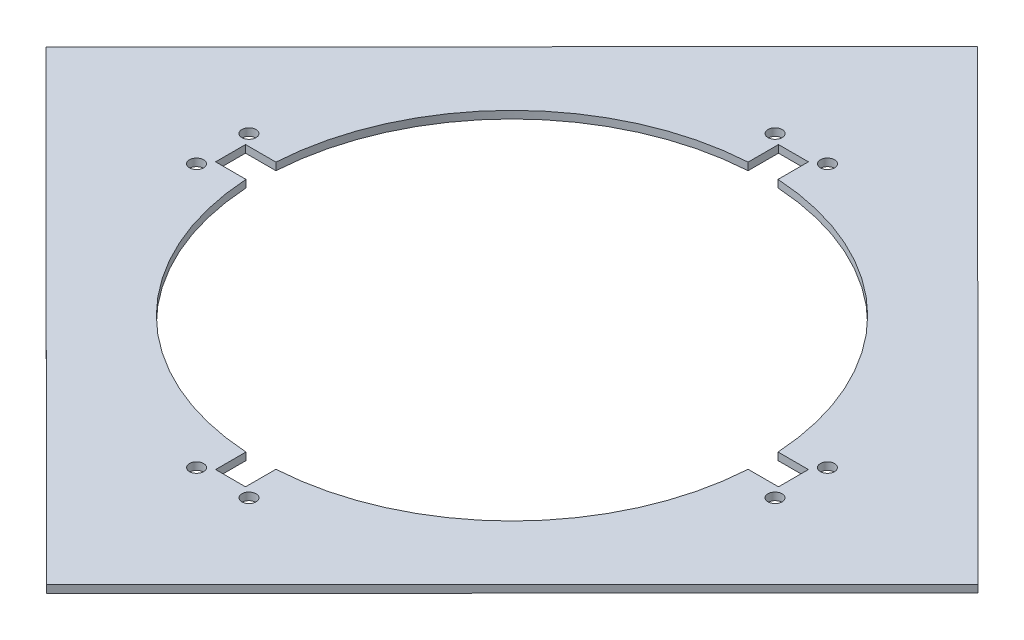
from build123d import *

# Parameters (mm, degrees)
SKETCH1_R           = 1.5
SKETCH1_R_2         = 53.34
BOSS_EXTRUDE1_DEPTH = 1.5875
CUT_EXTRUDE3_DEPTH  = 140.70900378


with BuildPart() as part:
    # Sketch1 → Boss-Extrude1 (new body)
    with BuildSketch(Plane(origin=(0, 0, 0), x_dir=(1, 0, 0), z_dir=(0, 1, 0))):
        Polygon((0.047005036, -98.782806148), (-98.782806148, -0.047005036), (-0.047005036, 98.782806148), (98.782806148, 0.047005036), align=None)
        with Locations(Location((-61.346730494, 5.55625, 0), (0, 0, 270))):
            Circle(SKETCH1_R, mode=Mode.SUBTRACT)
        with Locations(Location((-61.346730494, -5.55625, 0), (0, 0, 270))):
            Circle(SKETCH1_R, mode=Mode.SUBTRACT)
        with Locations(Location((-5.55625, -61.346730494, 0), (0, 0, 270))):
            Circle(SKETCH1_R, mode=Mode.SUBTRACT)
        with Locations(Location((5.55625, -61.346730494, 0), (0, 0, 270))):
            Circle(SKETCH1_R, mode=Mode.SUBTRACT)
        with Locations(Location((61.346730494, -5.55625, 0), (0, 0, 270))):
            Circle(SKETCH1_R, mode=Mode.SUBTRACT)
        with Locations(Location((61.346730494, 5.55625, 0), (0, 0, 270))):
            Circle(SKETCH1_R, mode=Mode.SUBTRACT)
        with Locations(Location((5.55625, 61.346730494, 0), (0, 0, 270))):
            Circle(SKETCH1_R, mode=Mode.SUBTRACT)
        with Locations(Location((-5.55625, 61.346730494, 0), (0, 0, 270))):
            Circle(SKETCH1_R, mode=Mode.SUBTRACT)
        with Locations(Location((0, 0, 0), (0, 0, 270))):
            Circle(SKETCH1_R_2, mode=Mode.SUBTRACT)
    extrude(amount=BOSS_EXTRUDE1_DEPTH)

    # Sketch2 → Cut-Extrude3 (cut, through all)
    with BuildSketch(Plane(origin=(0, 1.5875, 0), x_dir=(1, 0, 0), z_dir=(0, 1, 0))):
        Polygon((3.175, 53.34), (3.175, 59.69), (-3.175, 59.69), (-3.175, 53.34), (-3.175, 52.244537665), (3.175, 52.244537665), align=None)
        Polygon((53.34, -3.175), (59.69, -3.175), (59.69, 3.175), (53.34, 3.175), (52.244537665, 3.175), (52.244537665, -3.175), align=None)
        Polygon((-3.175, -53.34), (-3.175, -59.69), (3.175, -59.69), (3.175, -53.34), (3.175, -52.244537665), (-3.175, -52.244537665), align=None)
        Polygon((-53.34, 3.175), (-59.69, 3.175), (-59.69, -3.175), (-53.34, -3.175), (-52.244537665, -3.175), (-52.244537665, 3.175), align=None)
    extrude(amount=-CUT_EXTRUDE3_DEPTH, mode=Mode.SUBTRACT)


solid = part.part
